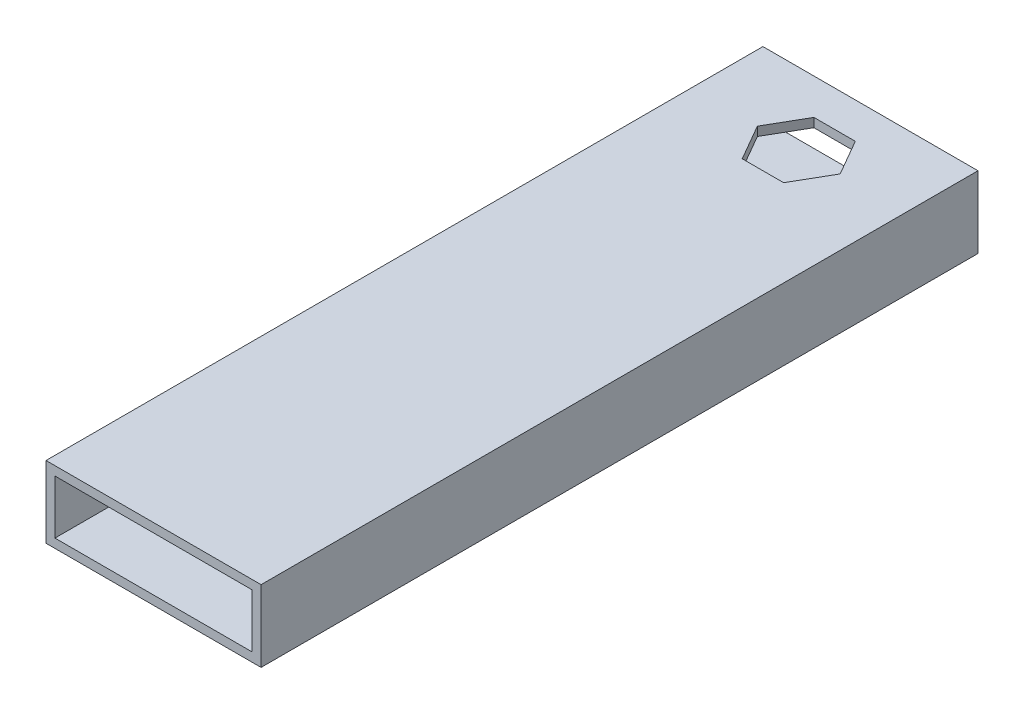
from build123d import *

# Parameters (mm, degrees)
SKETCH1_W           = 38.1
SKETCH1_H           = 12.7
BOSS_EXTRUDE1_DEPTH = 127
SKETCH2_W           = 34.925
SKETCH2_H           = 9.525
CUT_EXTRUDE1_DEPTH  = 134.198723718
CUT_EXTRUDE2_DEPTH  = 134.198723718


with BuildPart() as part:
    # Sketch1 → Boss-Extrude1 (new body)
    with BuildSketch(Plane.XY):
        with Locations((19.05, 6.35)):
            Rectangle(SKETCH1_W, SKETCH1_H)
    extrude(amount=BOSS_EXTRUDE1_DEPTH)

    # Sketch2 → Cut-Extrude1 (cut, through all)
    with BuildSketch(Plane.XY.offset(127)):
        with Locations((19.05, 6.35)):
            Rectangle(SKETCH2_W, SKETCH2_H)
    extrude(amount=-CUT_EXTRUDE1_DEPTH, mode=Mode.SUBTRACT)

    # Sketch3 → Cut-Extrude2 (cut, through all)
    with BuildSketch(Plane.XZ):
        Polygon((26.382348419, 12.7), (22.716174209, 19.05), (15.383825791, 19.05), (11.717651581, 12.7), (15.383825791, 6.35), (22.716174209, 6.35), align=None)
    extrude(amount=-CUT_EXTRUDE2_DEPTH, mode=Mode.SUBTRACT)


solid = part.part
